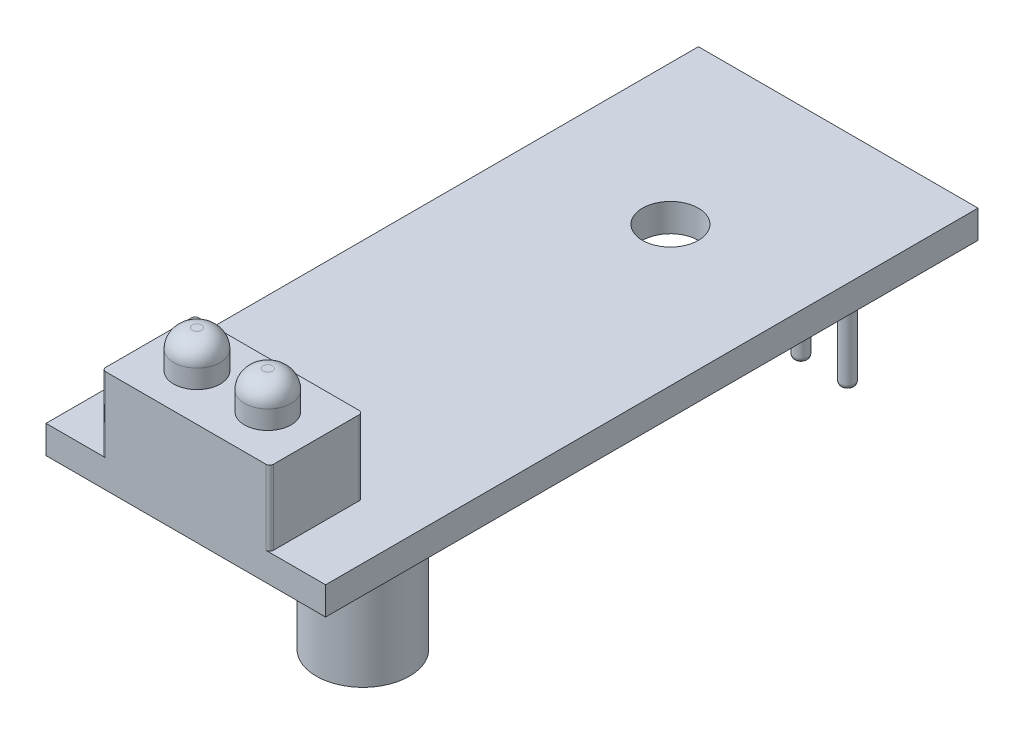
from build123d import *

# Parameters (mm, degrees)
SKETCH1_W           = 15
SKETCH1_H           = 35
BOSS_EXTRUDE1_DEPTH = 1.5
SKETCH2_W           = 9
SKETCH2_H           = 5
BOSS_EXTRUDE2_DEPTH = 4
FILLET1_R           = 0.2
SKETCH3_R           = 1.25
BOSS_EXTRUDE3_DEPTH = 2
FILLET2_R           = 1
SKETCH4_W           = 3
SKETCH4_H           = 3
BOSS_EXTRUDE4_DEPTH = 1
SKETCH5_R           = 2.5
BOSS_EXTRUDE5_DEPTH = 7.5
SKETCH6_W           = 2.4
SKETCH6_H           = 2.4
BOSS_EXTRUDE6_DEPTH = 2
FILLET3_R           = 0.1
SKETCH7_R           = 0.375
BOSS_EXTRUDE7_DEPTH = 5
FILLET4_R           = 0.2
SKETCH8_R           = 1.5
CUT_EXTRUDE1_DEPTH  = 21.46338193


with BuildPart() as part:
    # Sketch1 → Boss-Extrude1 (new body)
    with BuildSketch(Plane(origin=(0, 0, 0), x_dir=(1, 0, 0), z_dir=(0, 1, 0))):
        Rectangle(SKETCH1_W, SKETCH1_H)
    extrude(amount=BOSS_EXTRUDE1_DEPTH)

    # Sketch2 → Boss-Extrude2 (add)
    with BuildSketch(Plane(origin=(0, 1.5, 0), x_dir=(1, 0, 0), z_dir=(0, 1, 0))):
        with Locations((0, -15)):
            Rectangle(SKETCH2_W, SKETCH2_H)
    extrude(amount=BOSS_EXTRUDE2_DEPTH)

    # Fillet1
    fillet1_edges = [part.edges().sort_by_distance(p)[0] for p in [
        (4.5, 3.5, 17.5),
        (4.5, 3.5, 12.5),
        (-4.5, 3.5, 17.5),
        (-4.5, 3.5, 12.5),
    ]]
    fillet(fillet1_edges, radius=FILLET1_R)

    # Sketch3 → Boss-Extrude3 (add)
    with BuildSketch(Plane(origin=(0, 5.5, 0), x_dir=(1, 0, 0), z_dir=(0, 1, 0))):
        with Locations(Location((-1.9, -15, 0), (0, 0, 270))):
            Circle(SKETCH3_R)
        with Locations(Location((1.9, -15, 0), (0, 0, 90))):
            Circle(SKETCH3_R)
    extrude(amount=BOSS_EXTRUDE3_DEPTH)

    # Fillet2
    fillet2_edges = [part.edges().sort_by_distance(p)[0] for p in [
        (-1.9, 7.5, 13.75),
        (1.9, 7.5, 16.25),
    ]]
    fillet(fillet2_edges, radius=FILLET2_R)

    # Sketch4 → Boss-Extrude4 (add)
    with BuildSketch(Plane.XZ):
        with Locations((-5, 11)):
            Rectangle(SKETCH4_W, SKETCH4_H)
    extrude(amount=BOSS_EXTRUDE4_DEPTH)

    # Sketch5 → Boss-Extrude5 (add)
    with BuildSketch(Plane.XZ):
        with Locations(Location((2.5, 10.5, 0), (0, 0, 90))):
            Circle(SKETCH5_R)
    extrude(amount=BOSS_EXTRUDE5_DEPTH)

    # Sketch6 → Boss-Extrude6 (add)
    with BuildSketch(Plane.XZ):
        with Locations((-3.8, -14.3)):
            Rectangle(SKETCH6_W, SKETCH6_H)
        with Locations((-1.3, -14.3)):
            Rectangle(SKETCH6_W, SKETCH6_H)
        with Locations((1.2, -14.3)):
            Rectangle(SKETCH6_W, SKETCH6_H)
        with Locations((3.7, -14.3)):
            Rectangle(SKETCH6_W, SKETCH6_H)
    extrude(amount=BOSS_EXTRUDE6_DEPTH)

    # Fillet3
    fillet3_edges = [part.edges().sort_by_distance(p)[0] for p in [
        (-2.5, -1, -15.5),
        (-0.1, -1, -15.5),
        (-0.1, -1, -13.1),
        (-2.5, -1, -13.1),
        (0, -1, -15.5),
        (2.4, -1, -15.5),
        (2.4, -1, -13.1),
        (0, -1, -13.1),
        (2.5, -1, -15.5),
        (4.9, -1, -15.5),
        (4.9, -1, -13.1),
        (2.5, -1, -13.1),
        (-2.6, -1, -15.5),
        (-2.6, -1, -13.1),
        (-5, -1, -13.1),
        (-5, -1, -15.5),
    ]]
    fillet(fillet3_edges, radius=FILLET3_R)

    # Sketch7 → Boss-Extrude7 (add)
    with BuildSketch(Plane.XZ.offset(2)):
        with Locations(Location((-3.8, -14.3, 0), (0, 0, 270))):
            Circle(SKETCH7_R)
        with Locations(Location((-1.3, -14.3, 0), (0, 0, 90))):
            Circle(SKETCH7_R)
        with Locations(Location((1.2, -14.3, 0), (0, 0, 90))):
            Circle(SKETCH7_R)
        with Locations(Location((3.7, -14.3, 0), (0, 0, 90))):
            Circle(SKETCH7_R)
    extrude(amount=BOSS_EXTRUDE7_DEPTH)

    # Fillet4
    fillet4_edges = [part.edges().sort_by_distance(p)[0] for p in [
        (-3.8, -7, -13.925),
        (-1.3, -7, -14.675),
        (1.2, -7, -14.675),
        (3.7, -7, -14.675),
    ]]
    fillet(fillet4_edges, radius=FILLET4_R)

    # Sketch8 → Cut-Extrude1 (cut, through all)
    with BuildSketch(Plane.XZ):
        with Locations(Location((0, -8.5, 0), (0, 0, 270))):
            Circle(SKETCH8_R)
    extrude(amount=-CUT_EXTRUDE1_DEPTH, mode=Mode.SUBTRACT)


solid = part.part
